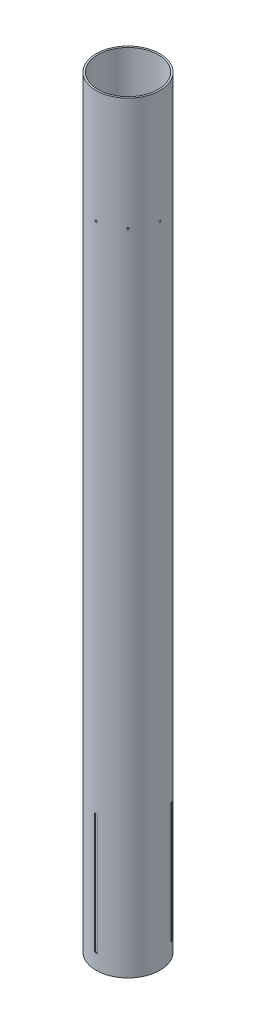
from build123d import *

# Parameters (mm, degrees)
SKETCH1_R                    = 53.721
SKETCH1_R_2                  = 50.8
TUBE_EXTRUSION_DEPTH         = 1282.7
ENGINE_BLOCK_HOLE_REACH      = 1290.312
ENGINE_BLOCK_HOLE_END_RADIUS = 50.8
SKETCH2_R                    = 1.6383
CIRPATTERN1_COUNT            = 8
SKETCH3_W                    = 5.334
SKETCH3_H                    = 203.2
FIN_SLOTS_DEPTH              = 1.27
CIRPATTERN2_COUNT            = 3


with BuildPart() as part:
    # Sketch1 → Tube Extrusion (new body)
    with BuildSketch(Plane(origin=(0, 0, 0), x_dir=(1, 0, 0), z_dir=(0, 1, 0))):
        with Locations(Location((0, 0, 0), (0, 0, 90))):
            Circle(SKETCH1_R)
        with Locations(Location((0, 0, 0), (0, 0, 90))):
            Circle(SKETCH1_R_2, mode=Mode.SUBTRACT)
    extrude(amount=TUBE_EXTRUSION_DEPTH)

    # Engine Block Hole: up to this cylinder (the profile starts outside it)
    engine_block_hole_end = Plane(origin=(0, 1092.2, 0), z_dir=(0, -1, 0)) * Cylinder(ENGINE_BLOCK_HOLE_END_RADIUS, 2683.224, mode=Mode.PRIVATE)
    # Sketch2 → Engine Block Hole (cut, up to the surface)
    with BuildSketch(Plane.XY.offset(53.721), mode=Mode.PRIVATE) as engine_block_hole_sk1:
        with Locations((0, 1092.2)):
            Circle(SKETCH2_R)
    engine_block_hole_tool1 = extrude(engine_block_hole_sk1.sketch, amount=-ENGINE_BLOCK_HOLE_REACH, mode=Mode.PRIVATE) - engine_block_hole_end
    engine_block_hole = engine_block_hole_tool1.solids().sort_by_distance((0, 1092.2, 53.721))[0]
    add(engine_block_hole, mode=Mode.SUBTRACT)

    # CirPattern1: Engine Block Hole ×8 about axis
    cirpattern1_axis = Axis((0, 1282.7, 0), (0, -1, 0))
    for i in range(1, CIRPATTERN1_COUNT):
        add(engine_block_hole.rotate(cirpattern1_axis, i * 360 / CIRPATTERN1_COUNT), mode=Mode.SUBTRACT)

    # Sketch3 → Fin Slots (cut)
    with BuildSketch(Plane.XY.offset(53.721)):
        with Locations((0, 127)):
            Rectangle(SKETCH3_W, SKETCH3_H)
    fin_slots = extrude(amount=-FIN_SLOTS_DEPTH, mode=Mode.SUBTRACT)

    # CirPattern2: Fin Slots ×3 about axis
    cirpattern2_axis = Axis((0, 0, 0), (0, 1, 0))
    for i in range(1, CIRPATTERN2_COUNT):
        add(fin_slots.rotate(cirpattern2_axis, i * 360 / CIRPATTERN2_COUNT), mode=Mode.SUBTRACT)


solid = part.part
